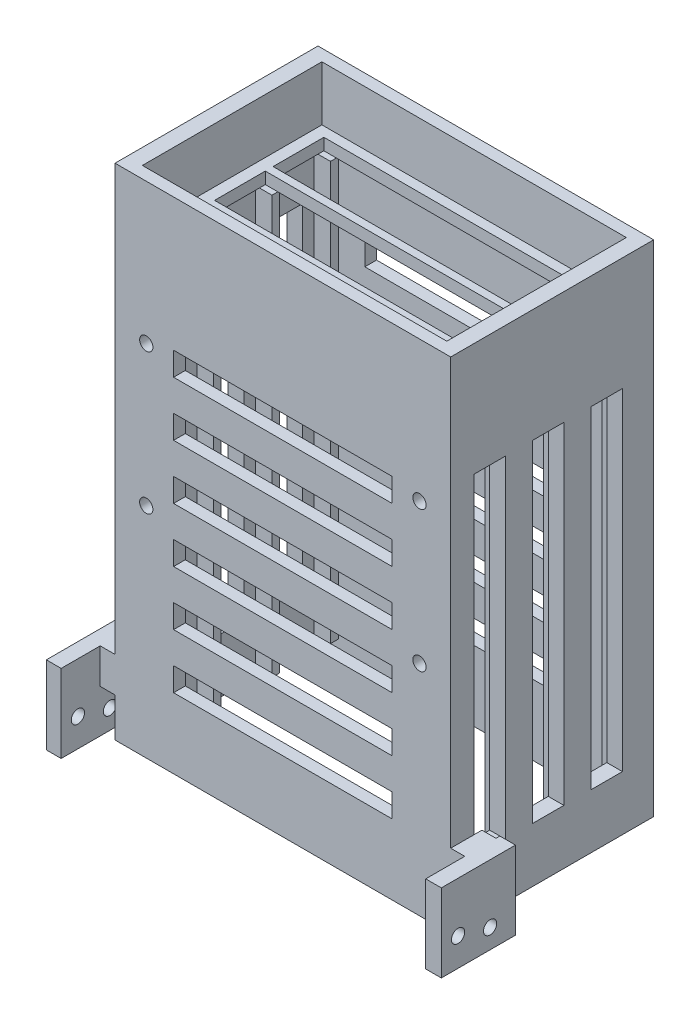
from build123d import *

# Parameters (mm, degrees)
SKETCH_1_W                        = 86
SKETCH_1_H                        = 128
FLOOR_1_DEPTH                     = 3
SKETCH_2_W                        = 4
SKETCH_2_H                        = 128
LEFT_WALL_2_DEPTH                 = 49
SKETCH_3_W                        = 4
SKETCH_3_H                        = 128
RIGHT_WALL_3_DEPTH                = 49
SKETCH_4_W                        = 4.2
SKETCH_4_H                        = 107
LEFT_RAIL_0_4_DEPTH               = 2
SKETCH_5_W                        = 4.2
SKETCH_5_H                        = 107
RIGHT_RAIL_0_5_DEPTH              = 2
SKETCH_6_W                        = 4.2
SKETCH_6_H                        = 107
LEFT_RAIL_1_6_DEPTH               = 2
SKETCH_7_W                        = 4.2
SKETCH_7_H                        = 107
RIGHT_RAIL_1_7_DEPTH              = 2
SKETCH_8_W                        = 4.2
SKETCH_8_H                        = 107
LEFT_RAIL_2_8_DEPTH               = 2
SKETCH_9_W                        = 4.2
SKETCH_9_H                        = 107
RIGHT_RAIL_2_9_DEPTH              = 2
SKETCH_10_W                       = 78
SKETCH_10_H                       = 3
REAR_STOP_10_DEPTH                = 46
SKETCH_11_W                       = 86
SKETCH_11_H                       = 128
ROOF_11_DEPTH                     = 3
SKETCH_12_W                       = 8
SKETCH_12_H                       = 85
SIDE_AIRFLOW_0_12_DEPTH           = 88
SKETCH_13_W                       = 8
SKETCH_13_H                       = 85
SIDE_AIRFLOW_1_13_DEPTH           = 88
SKETCH_14_W                       = 8
SKETCH_14_H                       = 85
SIDE_AIRFLOW_2_14_DEPTH           = 88
SKETCH_15_W                       = 56
SKETCH_15_H                       = 6
FLOOR_ROOF_AIRFLOW_15_DEPTH       = 55
SKETCH_16_R                       = 1.7
BASE_ROOF_M3_16_DEPTH             = 5
SKETCH_18_R                       = 1.3
TRAY_LOCK_M3_0_18_DEPTH           = 12
SKETCH_19_R                       = 1.3
TRAY_LOCK_M3_1_19_DEPTH           = 12
SKETCH_20_R                       = 1.3
TRAY_LOCK_M3_2_20_DEPTH           = 12
SKETCH_21_R                       = 1.3
PANEL_M3_PILOTS_1_DEPTH           = 14
SKETCH_22_W                       = 72
SKETCH_22_H                       = 13
REAR_SATA_USB_PASSAGE_0_101_DEPTH = 7
SKETCH_23_W                       = 72
SKETCH_23_H                       = 13
REAR_SATA_USB_PASSAGE_1_102_DEPTH = 7
SKETCH_24_W                       = 72
SKETCH_24_H                       = 13
REAR_SATA_USB_PASSAGE_2_103_DEPTH = 7
SKETCH_25_W                       = 7.6
SKETCH_25_H                       = 9
RIGHT_HINGE_FOOT_104_DEPTH        = 8
SKETCH_26_W                       = 7.6
SKETCH_26_H                       = 9
LEFT_HINGE_FOOT_105_DEPTH         = 8
SKETCH_27_W                       = 4
SKETCH_27_H                       = 20
RIGHT_ANGLE_BRACKET_106_DEPTH     = 19
SKETCH_28_W                       = 3.8
SKETCH_28_H                       = 20
LEFT_ANGLE_BRACKET_107_DEPTH      = 19
SKETCH_29_R                       = 1.7
M3_FIXED_15DEG_HINGE_108_DEPTH    = 104


with BuildPart() as part:
    # Эскиз1 → Floor_1 (new body)
    with BuildSketch(Plane.XY):
        Rectangle(SKETCH_1_W, SKETCH_1_H)
    extrude(amount=FLOOR_1_DEPTH)

    # Эскиз2 → Left_wall_2 (add)
    with BuildSketch(Plane.XY.offset(3)):
        with Locations((-41, 0)):
            Rectangle(SKETCH_2_W, SKETCH_2_H)
    extrude(amount=LEFT_WALL_2_DEPTH)

    # Эскиз3 → Right_wall_3 (add)
    with BuildSketch(Plane.XY.offset(3)):
        with Locations((41, 0)):
            Rectangle(SKETCH_3_W, SKETCH_3_H)
    extrude(amount=RIGHT_WALL_3_DEPTH)

    # Эскиз4 → Left_rail_0_4 (add)
    with BuildSketch(Plane.XY.offset(3)):
        with Locations((-36.9, -8.5)):
            Rectangle(SKETCH_4_W, SKETCH_4_H)
    extrude(amount=LEFT_RAIL_0_4_DEPTH)

    # Эскиз5 → Right_rail_0_5 (add)
    with BuildSketch(Plane.XY.offset(3)):
        with Locations((36.9, -8.5)):
            Rectangle(SKETCH_5_W, SKETCH_5_H)
    extrude(amount=RIGHT_RAIL_0_5_DEPTH)

    # Эскиз6 → Left_rail_1_6 (add)
    with BuildSketch(Plane.XY.offset(18)):
        with Locations((-36.9, -8.5)):
            Rectangle(SKETCH_6_W, SKETCH_6_H)
    extrude(amount=LEFT_RAIL_1_6_DEPTH)

    # Эскиз7 → Right_rail_1_7 (add)
    with BuildSketch(Plane.XY.offset(18)):
        with Locations((36.9, -8.5)):
            Rectangle(SKETCH_7_W, SKETCH_7_H)
    extrude(amount=RIGHT_RAIL_1_7_DEPTH)

    # Эскиз8 → Left_rail_2_8 (add)
    with BuildSketch(Plane.XY.offset(33)):
        with Locations((-36.9, -8.5)):
            Rectangle(SKETCH_8_W, SKETCH_8_H)
    extrude(amount=LEFT_RAIL_2_8_DEPTH)

    # Эскиз9 → Right_rail_2_9 (add)
    with BuildSketch(Plane.XY.offset(33)):
        with Locations((36.9, -8.5)):
            Rectangle(SKETCH_9_W, SKETCH_9_H)
    extrude(amount=RIGHT_RAIL_2_9_DEPTH)

    # Эскиз10 → Rear_stop_10 (add)
    with BuildSketch(Plane.XY.offset(3)):
        with Locations((0, 48.5)):
            Rectangle(SKETCH_10_W, SKETCH_10_H)
    extrude(amount=REAR_STOP_10_DEPTH)

    # Эскиз11 → Roof_11 (add)
    with BuildSketch(Plane.XY.offset(49)):
        Rectangle(SKETCH_11_W, SKETCH_11_H)
    extrude(amount=ROOF_11_DEPTH)

    # Эскиз12 → Side_airflow_0_12 (cut)
    with BuildSketch(Plane(origin=(-44, 0, 0), x_dir=(0, 0, -1), z_dir=(1, 0, 0))):
        with Locations((-12, -7.5)):
            Rectangle(SKETCH_12_W, SKETCH_12_H)
    extrude(amount=SIDE_AIRFLOW_0_12_DEPTH, mode=Mode.SUBTRACT)

    # Эскиз13 → Side_airflow_1_13 (cut)
    with BuildSketch(Plane(origin=(-44, 0, 0), x_dir=(0, 0, -1), z_dir=(1, 0, 0))):
        with Locations((-27, -7.5)):
            Rectangle(SKETCH_13_W, SKETCH_13_H)
    extrude(amount=SIDE_AIRFLOW_1_13_DEPTH, mode=Mode.SUBTRACT)

    # Эскиз14 → Side_airflow_2_14 (cut)
    with BuildSketch(Plane(origin=(-44, 0, 0), x_dir=(0, 0, -1), z_dir=(1, 0, 0))):
        with Locations((-42, -7.5)):
            Rectangle(SKETCH_14_W, SKETCH_14_H)
    extrude(amount=SIDE_AIRFLOW_2_14_DEPTH, mode=Mode.SUBTRACT)

    # Эскиз15 → Floor_roof_airflow_15 (cut)
    with BuildSketch(Plane.XY.offset(-1)):
        with Locations((0, -43)):
            Rectangle(SKETCH_15_W, SKETCH_15_H)
        with Locations((0, -29)):
            Rectangle(SKETCH_15_W, SKETCH_15_H)
        with Locations((0, -15)):
            Rectangle(SKETCH_15_W, SKETCH_15_H)
        with Locations((0, -1)):
            Rectangle(SKETCH_15_W, SKETCH_15_H)
        with Locations((0, 13)):
            Rectangle(SKETCH_15_W, SKETCH_15_H)
        with Locations((0, 27)):
            Rectangle(SKETCH_15_W, SKETCH_15_H)
    extrude(amount=FLOOR_ROOF_AIRFLOW_15_DEPTH, mode=Mode.SUBTRACT)

    # Эскиз16 → Base_roof_M3_16 (cut)
    with BuildSketch(Plane.XY.offset(48)):
        with Locations(Location((-35, -8, 0), (0, 0, 180))):
            Circle(SKETCH_16_R)
        with Locations(Location((35, -8, 0), (0, 0, 180))):
            Circle(SKETCH_16_R)
        with Locations(Location((-35, 28, 0), (0, 0, 180))):
            Circle(SKETCH_16_R)
        with Locations(Location((35, 28, 0), (0, 0, 180))):
            Circle(SKETCH_16_R)
    extrude(amount=BASE_ROOF_M3_16_DEPTH, mode=Mode.SUBTRACT)

    # Эскиз18 → Tray_lock_M3_0_18 (cut)
    with BuildSketch(Plane(origin=(0, -65, 0), x_dir=(1, 0, 0), z_dir=(0, 1, 0))):
        with Locations(Location((-41, -10, 0), (0, 0, 270))):
            Circle(SKETCH_18_R)
        with Locations(Location((41, -10, 0), (0, 0, 270))):
            Circle(SKETCH_18_R)
    extrude(amount=TRAY_LOCK_M3_0_18_DEPTH, mode=Mode.SUBTRACT)

    # Эскиз19 → Tray_lock_M3_1_19 (cut)
    with BuildSketch(Plane(origin=(0, -65, 0), x_dir=(1, 0, 0), z_dir=(0, 1, 0))):
        with Locations(Location((-41, -25, 0), (0, 0, 270))):
            Circle(SKETCH_19_R)
        with Locations(Location((41, -25, 0), (0, 0, 270))):
            Circle(SKETCH_19_R)
    extrude(amount=TRAY_LOCK_M3_1_19_DEPTH, mode=Mode.SUBTRACT)

    # Эскиз20 → Tray_lock_M3_2_20 (cut)
    with BuildSketch(Plane(origin=(0, -65, 0), x_dir=(1, 0, 0), z_dir=(0, 1, 0))):
        with Locations(Location((-41, -40, 0), (0, 0, 270))):
            Circle(SKETCH_20_R)
        with Locations(Location((41, -40, 0), (0, 0, 270))):
            Circle(SKETCH_20_R)
    extrude(amount=TRAY_LOCK_M3_2_20_DEPTH, mode=Mode.SUBTRACT)

    # Эскиз21 → Panel_M3_pilots_1 (cut)
    with BuildSketch(Plane(origin=(0, -65, 0), x_dir=(1, 0, 0), z_dir=(0, 1, 0))):
        with Locations(Location((-41, -49.5, 0), (0, 0, 270))):
            Circle(SKETCH_21_R)
        with Locations(Location((41, -49.5, 0), (0, 0, 270))):
            Circle(SKETCH_21_R)
    extrude(amount=PANEL_M3_PILOTS_1_DEPTH, mode=Mode.SUBTRACT)

    # Эскиз22 → Rear_SATA_USB_passage_0_101 (cut)
    with BuildSketch(Plane(origin=(0, 46, 0), x_dir=(1, 0, 0), z_dir=(0, 1, 0))):
        with Locations((0, -12)):
            Rectangle(SKETCH_22_W, SKETCH_22_H)
    extrude(amount=REAR_SATA_USB_PASSAGE_0_101_DEPTH, mode=Mode.SUBTRACT)

    # Эскиз23 → Rear_SATA_USB_passage_1_102 (cut)
    with BuildSketch(Plane(origin=(0, 46, 0), x_dir=(1, 0, 0), z_dir=(0, 1, 0))):
        with Locations((0, -27)):
            Rectangle(SKETCH_23_W, SKETCH_23_H)
    extrude(amount=REAR_SATA_USB_PASSAGE_1_102_DEPTH, mode=Mode.SUBTRACT)

    # Эскиз24 → Rear_SATA_USB_passage_2_103 (cut)
    with BuildSketch(Plane(origin=(0, 46, 0), x_dir=(1, 0, 0), z_dir=(0, 1, 0))):
        with Locations((0, -42)):
            Rectangle(SKETCH_24_W, SKETCH_24_H)
    extrude(amount=REAR_SATA_USB_PASSAGE_2_103_DEPTH, mode=Mode.SUBTRACT)

    # Эскиз25 → Right_hinge_foot_104 (add)
    with BuildSketch(Plane.XY.offset(44)):
        with Locations((46.8, -49.5)):
            Rectangle(SKETCH_25_W, SKETCH_25_H)
    extrude(amount=RIGHT_HINGE_FOOT_104_DEPTH)

    # Эскиз26 → Left_hinge_foot_105 (add)
    with BuildSketch(Plane.XY.offset(44)):
        with Locations((-46.8, -49.5)):
            Rectangle(SKETCH_26_W, SKETCH_26_H)
    extrude(amount=LEFT_HINGE_FOOT_105_DEPTH)

    # Эскиз27 → Right_angle_bracket_106 (add)
    with BuildSketch(Plane.XY.offset(43)):
        with Locations((48.6, -55)):
            Rectangle(SKETCH_27_W, SKETCH_27_H)
    extrude(amount=RIGHT_ANGLE_BRACKET_106_DEPTH)

    # Эскиз28 → Left_angle_bracket_107 (add)
    with BuildSketch(Plane.XY.offset(43)):
        with Locations((-48.7, -55)):
            Rectangle(SKETCH_28_W, SKETCH_28_H)
    extrude(amount=LEFT_ANGLE_BRACKET_107_DEPTH)

    # Эскиз29 → M3_fixed_15deg_hinge_108 (cut)
    with BuildSketch(Plane(origin=(-52, 0, 0), x_dir=(0, 0, -1), z_dir=(1, 0, 0))):
        with Locations(Location((-49.5, -60, 0), (0, 0, 180))):
            Circle(SKETCH_29_R)
        with Locations(Location((-57.710369523, -57.800038117, 0), (0, 0, 180))):
            Circle(SKETCH_29_R)
    extrude(amount=M3_FIXED_15DEG_HINGE_108_DEPTH, mode=Mode.SUBTRACT)


solid = part.part
